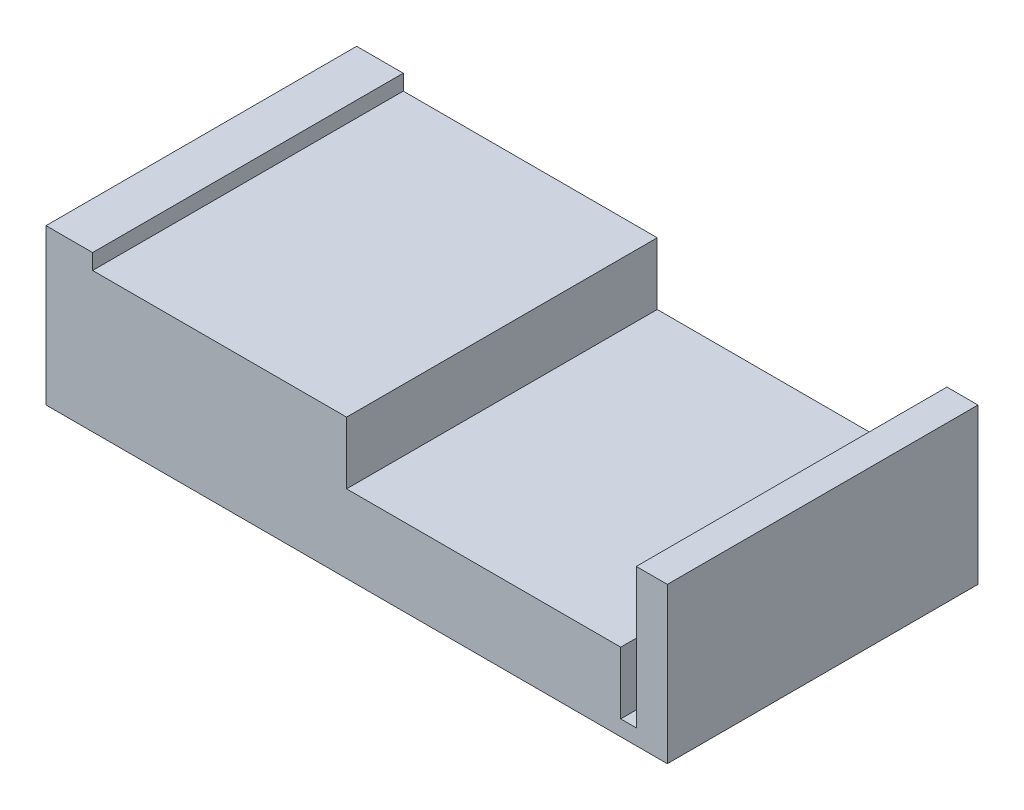
from build123d import *

# Parameters (mm, degrees)
SKETCH_1_W          = 200
SKETCH_1_H          = 100
EXTRUDE_1_DEPTH     = 50
SKETCH_2_W          = 81.752741681
SKETCH_2_H          = 100
CUT_EXTRUDE_1_DEPTH = 5
SKETCH_3_W          = 93.247258319
SKETCH_3_H          = 100
CUT_EXTRUDE_2_DEPTH = 25
SKETCH_4_W          = 5
SKETCH_4_H          = 100
CUT_EXTRUDE_3_DEPTH = 20


with BuildPart() as part:
    # 草图1 → 凸台-拉伸1 (new body)
    with BuildSketch(Plane(origin=(0, 0, 0), x_dir=(1, 0, 0), z_dir=(0, 1, 0))):
        with Locations((100, 50)):
            Rectangle(SKETCH_1_W, SKETCH_1_H)
    extrude(amount=EXTRUDE_1_DEPTH)

    # 草图2 → 切除-拉伸1 (cut)
    with BuildSketch(Plane(origin=(0, 50, 0), x_dir=(1, 0, 0), z_dir=(0, 1, 0))):
        with Locations((55.876370841, 50)):
            Rectangle(SKETCH_2_W, SKETCH_2_H)
    extrude(amount=-CUT_EXTRUDE_1_DEPTH, mode=Mode.SUBTRACT)

    # 草图3 → 切除-拉伸2 (cut)
    with BuildSketch(Plane(origin=(0, 50, 0), x_dir=(1, 0, 0), z_dir=(0, 1, 0))):
        with Locations((143.37637084, 50)):
            Rectangle(SKETCH_3_W, SKETCH_3_H)
    extrude(amount=-CUT_EXTRUDE_2_DEPTH, mode=Mode.SUBTRACT)

    # 草图4 → 切除-拉伸3 (cut)
    with BuildSketch(Plane(origin=(0, 25, 0), x_dir=(1, 0, 0), z_dir=(0, 1, 0))):
        with Locations((187.5, 50)):
            Rectangle(SKETCH_4_W, SKETCH_4_H)
    extrude(amount=-CUT_EXTRUDE_3_DEPTH, mode=Mode.SUBTRACT)


solid = part.part
